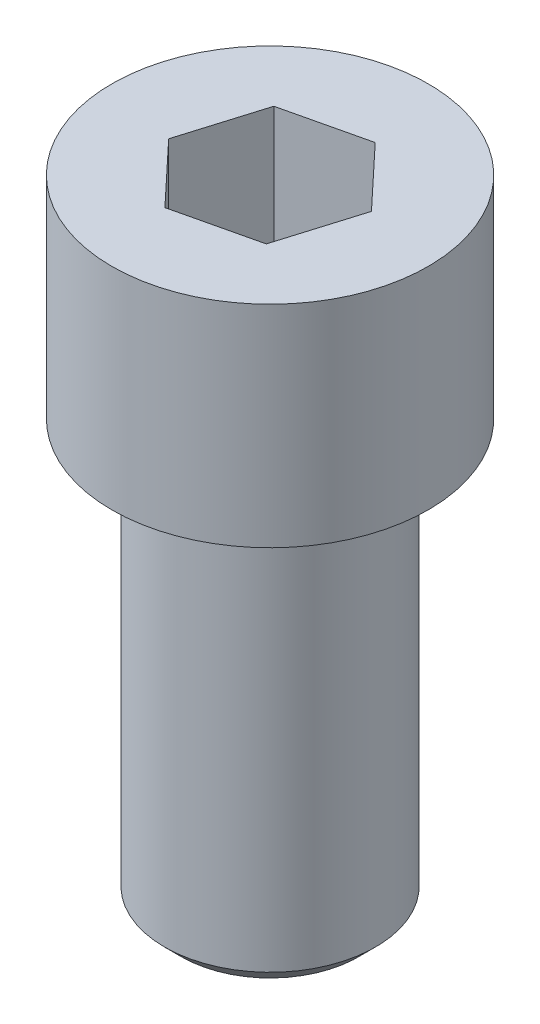
from build123d import *

# Parameters (mm, degrees)
SKETCH2_R           = 0.1875
BOSS_EXTRUDE2_DEPTH = 0.75
CUT_EXTRUDE1_DEPTH  = 0.15
SKETCH4_R           = 0.1875
SKETCH4_R_2         = 0.125
CUT_EXTRUDE2_DEPTH  = 0.5
CHAMFER1_SIZE       = 0.02
FILLET1_R           = 0.015


with BuildPart() as part:
    # Sketch2 → Boss-Extrude2 (new body)
    with BuildSketch(Plane(origin=(0, 0, 0), x_dir=(1, 0, 0), z_dir=(0, 1, 0))):
        with Locations(Location((0, 0, 0), (0, 0, 270))):
            Circle(SKETCH2_R)
    extrude(amount=BOSS_EXTRUDE2_DEPTH)

    # Sketch3 → Cut-Extrude1 (cut)
    with BuildSketch(Plane(origin=(0, 0.75, 0), x_dir=(1, 0, 0), z_dir=(0, 1, 0))):
        Polygon((0.068443591, -0.072907303), (0.097361372, 0.022820237), (0.028917781, 0.09572754), (-0.068443591, 0.072907303), (-0.097361372, -0.022820237), (-0.028917781, -0.09572754), align=None)
    extrude(amount=-CUT_EXTRUDE1_DEPTH, mode=Mode.SUBTRACT)

    # Sketch4 → Cut-Extrude2 (cut)
    with BuildSketch(Plane(origin=(0, 0, 0), x_dir=(1, 0, 0), z_dir=(0, 1, 0))):
        with Locations(Location((0, 0, 0), (0, 0, 270))):
            Circle(SKETCH4_R)
        with Locations(Location((0, 0, 0), (0, 0, 270))):
            Circle(SKETCH4_R_2, mode=Mode.SUBTRACT)
    extrude(amount=CUT_EXTRUDE2_DEPTH, mode=Mode.SUBTRACT)

    # Chamfer1
    chamfer1_edges = [part.edges().sort_by_distance(p)[0] for p in [
        (0, 0, -0.125),
    ]]
    chamfer(chamfer1_edges, length=CHAMFER1_SIZE)

    # Fillet1
    fillet1_edges = [part.edges().sort_by_distance(p)[0] for p in [
        (0, 0.5, -0.125),
    ]]
    fillet(fillet1_edges, radius=FILLET1_R)


solid = part.part
